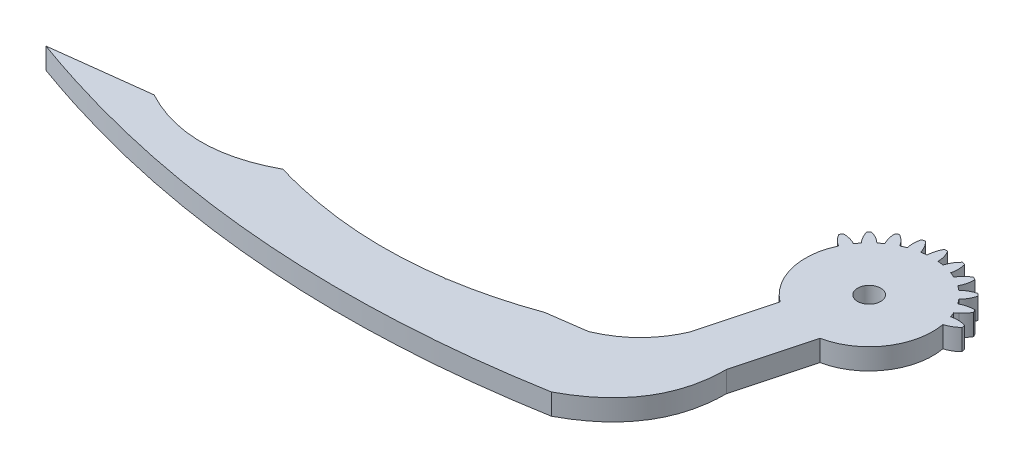
from build123d import *
from build123d.topology import SkipClean

# Parameters (mm, degrees)
SKETCH1_R           = 1.5
BOSS_EXTRUDE1_DEPTH = 4
SKETCH3_R           = 1.75
BOSS_EXTRUDE2_DEPTH = 4
CUT_EXTRUDE1_START  = -4
CUT_EXTRUDE1_DEPTH  = 4
CUT_EXTRUDE2_REACH  = 49.1
SKETCH5_R           = 2.2
BOSS_EXTRUDE3_START = -4
BOSS_EXTRUDE3_DEPTH = 4
CUT_EXTRUDE3_START  = -10
SKETCH6_3_R         = 1.75
CUT_EXTRUDE3_DEPTH  = 10


with BuildPart() as part:
    # Sketch1 → Boss-Extrude1 (new body)
    with BuildSketch(Plane(origin=(0, 0, 0), x_dir=(1, 0, 0), z_dir=(0, 1, 0))):
        with BuildLine():
            Line((19.858482165, 7.979459856), (1.45526727, 5.556630652))
            ThreePointArc((1.45526727, 5.556630652), (2.151210177, 6.241530576), (2.71243846, 7.040559518))
            ThreePointArc((2.71243846, 7.040559518), (2.559278977, 7.3125), (2.400351352, 7.581110245))
            ThreePointArc((2.400351352, 7.581110245), (1.062931662, 7.415362311), (-0.19179738, 6.923611525))
            ThreePointArc((-0.19179738, 6.923611525), (-0.512518948, 7.361599771), (-0.852574256, 7.784752716))
            ThreePointArc((-0.852574256, 7.784752716), (-0.0528317, 8.869453434), (0.453418198, 10.118402931))
            ThreePointArc((0.453418198, 10.118402931), (0.235094121, 10.341436675), (0.012060377, 10.559760751))
            ThreePointArc((0.012060377, 10.559760751), (-1.23688912, 10.053510854), (-2.321589838, 9.253768298))
            ThreePointArc((-2.321589838, 9.253768298), (-2.744742783, 9.593823606), (-3.182731029, 9.914545174))
            ThreePointArc((-3.182731029, 9.914545174), (-2.690980243, 11.169274216), (-2.525232309, 12.506693906))
            ThreePointArc((-2.525232309, 12.506693906), (-2.793842554, 12.66562153), (-3.065783036, 12.818781014))
            ThreePointArc((-3.065783036, 12.818781014), (-4.141148496, 12.006529247), (-4.981900329, 10.953296054))
            ThreePointArc((-4.981900329, 10.953296054), (-5.478647477, 11.172244217), (-5.984720485, 11.368677763))
            ThreePointArc((-5.984720485, 11.368677763), (-5.834473474, 12.707927419), (-6.020522951, 14.04267436))
            ThreePointArc((-6.020522951, 14.04267436), (-6.321114019, 14.126665209), (-6.623428946, 14.204222534))
            ThreePointArc((-6.623428946, 14.204222534), (-7.451925989, 13.141322514), (-7.991433089, 11.906374785))
            ThreePointArc((-7.991433089, 11.906374785), (-8.527921943, 11.989294847), (-9.067591674, 12.04805375))
            ThreePointArc((-9.067591674, 12.04805375), (-9.269087523, 13.380556368), (-9.794255446, 14.621669762))
            ThreePointArc((-9.794255446, 14.621669762), (-10.106342554, 14.625), (-10.418429662, 14.621669762))
            ThreePointArc((-10.418429662, 14.621669762), (-10.943597585, 13.380556368), (-11.145093433, 12.04805375))
            ThreePointArc((-11.145093433, 12.04805375), (-11.684763165, 11.989294847), (-12.221252019, 11.906374785))
            ThreePointArc((-12.221252019, 11.906374785), (-12.760759118, 13.141322514), (-13.589256162, 14.204222534))
            ThreePointArc((-13.589256162, 14.204222534), (-13.891571088, 14.126665209), (-14.192162157, 14.04267436))
            ThreePointArc((-14.192162157, 14.04267436), (-14.378211634, 12.707927419), (-14.227964623, 11.368677763))
            ThreePointArc((-14.227964623, 11.368677763), (-14.734037631, 11.172244217), (-15.230784779, 10.953296054))
            ThreePointArc((-15.230784779, 10.953296054), (-16.071536612, 12.006529247), (-17.146902071, 12.818781014))
            ThreePointArc((-17.146902071, 12.818781014), (-17.418842554, 12.66562153), (-17.687452799, 12.506693906))
            ThreePointArc((-17.687452799, 12.506693906), (-17.521704864, 11.169274216), (-17.029954079, 9.914545174))
            ThreePointArc((-17.029954079, 9.914545174), (-17.467942324, 9.593823606), (-17.89109527, 9.253768298))
            ThreePointArc((-17.89109527, 9.253768298), (-18.975795988, 10.053510854), (-20.224745485, 10.559760751))
            ThreePointArc((-20.224745485, 10.559760751), (-20.447779229, 10.341436675), (-20.666103305, 10.118402931))
            ThreePointArc((-20.666103305, 10.118402931), (-20.159853408, 8.869453434), (-19.360110852, 7.784752716))
            ThreePointArc((-19.360110852, 7.784752716), (-19.70016616, 7.361599771), (-20.020887728, 6.923611525))
            ThreePointArc((-20.020887728, 6.923611525), (-21.27561677, 7.415362311), (-22.61303646, 7.581110245))
            ThreePointArc((-22.61303646, 7.581110245), (-22.771964084, 7.3125), (-22.925123568, 7.040559518))
            ThreePointArc((-22.925123568, 7.040559518), (-22.112871801, 5.965194058), (-21.059638608, 5.124442225))
            ThreePointArc((-21.059638608, 5.124442225), (-21.278586771, 4.627695077), (-21.475020317, 4.121622069))
            ThreePointArc((-21.475020317, 4.121622069), (-22.814269973, 4.27186908), (-24.149016913, 4.085819603))
            ThreePointArc((-24.149016913, 4.085819603), (-24.233007763, 3.785228535), (-24.310565088, 3.482913608))
            ThreePointArc((-24.310565088, 3.482913608), (-23.247665068, 2.654416564), (-22.012717339, 2.114909465))
            ThreePointArc((-22.012717339, 2.114909465), (-22.095637401, 1.578420611), (-22.154396304, 1.03875088))
            ThreePointArc((-22.154396304, 1.03875088), (-23.486898922, 0.837255031), (-24.728012316, 0.312087108))
            ThreePointArc((-24.728012316, 0.312087108), (-24.731342554, 0), (-24.728012316, -0.312087108))
            ThreePointArc((-24.728012316, -0.312087108), (-23.486898922, -0.837255031), (-22.154396304, -1.03875088))
            ThreePointArc((-22.154396304, -1.03875088), (-22.095637401, -1.578420611), (-22.012717339, -2.114909465))
            ThreePointArc((-22.012717339, -2.114909465), (-23.247665068, -2.654416564), (-24.310565088, -3.482913608))
            ThreePointArc((-24.310565088, -3.482913608), (-24.233007763, -3.785228535), (-24.149016913, -4.085819603))
            ThreePointArc((-24.149016913, -4.085819603), (-22.814269973, -4.27186908), (-21.475020317, -4.121622069))
            ThreePointArc((-21.475020317, -4.121622069), (-21.278586771, -4.627695077), (-21.059638608, -5.124442225))
            ThreePointArc((-21.059638608, -5.124442225), (-22.112871801, -5.965194058), (-22.925123568, -7.040559518))
            ThreePointArc((-22.925123568, -7.040559518), (-22.771964084, -7.3125), (-22.61303646, -7.581110245))
            ThreePointArc((-22.61303646, -7.581110245), (-21.27561677, -7.415362311), (-20.020887728, -6.923611525))
            ThreePointArc((-20.020887728, -6.923611525), (-19.70016616, -7.361599771), (-19.360110852, -7.784752716))
            ThreePointArc((-19.360110852, -7.784752716), (-20.159853408, -8.869453434), (-20.666103305, -10.118402931))
            ThreePointArc((-20.666103305, -10.118402931), (-20.447779229, -10.341436675), (-20.224745485, -10.559760751))
            ThreePointArc((-20.224745485, -10.559760751), (-18.975795988, -10.053510854), (-17.89109527, -9.253768298))
            ThreePointArc((-17.89109527, -9.253768298), (-17.467942324, -9.593823606), (-17.029954079, -9.914545174))
            ThreePointArc((-17.029954079, -9.914545174), (-17.521704864, -11.169274216), (-17.687452799, -12.506693906))
            ThreePointArc((-17.687452799, -12.506693906), (-17.418842554, -12.66562153), (-17.146902071, -12.818781014))
            ThreePointArc((-17.146902071, -12.818781014), (-16.071536612, -12.006529247), (-15.230784779, -10.953296054))
            ThreePointArc((-15.230784779, -10.953296054), (-14.734037631, -11.172244217), (-14.227964623, -11.368677763))
            ThreePointArc((-14.227964623, -11.368677763), (-14.378211634, -12.707927419), (-14.192162157, -14.04267436))
            ThreePointArc((-14.192162157, -14.04267436), (-13.891571088, -14.126665209), (-13.589256162, -14.204222534))
            ThreePointArc((-13.589256162, -14.204222534), (-12.760759118, -13.141322514), (-12.221252019, -11.906374785))
            ThreePointArc((-12.221252019, -11.906374785), (-11.684763165, -11.989294847), (-11.145093433, -12.04805375))
            ThreePointArc((-11.145093433, -12.04805375), (-10.943597585, -13.380556368), (-10.418429662, -14.621669762))
            ThreePointArc((-10.418429662, -14.621669762), (-10.106342554, -14.625), (-9.794255446, -14.621669762))
            ThreePointArc((-9.794255446, -14.621669762), (-9.269087523, -13.380556368), (-9.067591674, -12.04805375))
            ThreePointArc((-9.067591674, -12.04805375), (-8.527921943, -11.989294847), (-7.991433089, -11.906374785))
            ThreePointArc((-7.991433089, -11.906374785), (-7.451925989, -13.141322514), (-6.623428946, -14.204222534))
            ThreePointArc((-6.623428946, -14.204222534), (-6.321114019, -14.126665209), (-6.020522951, -14.04267436))
            ThreePointArc((-6.020522951, -14.04267436), (-5.834473474, -12.707927419), (-5.984720485, -11.368677763))
            ThreePointArc((-5.984720485, -11.368677763), (-5.478647477, -11.172244217), (-4.981900329, -10.953296054))
            ThreePointArc((-4.981900329, -10.953296054), (-4.141148496, -12.006529247), (-3.065783036, -12.818781014))
            ThreePointArc((-3.065783036, -12.818781014), (-2.793842554, -12.66562153), (-2.525232309, -12.506693906))
            ThreePointArc((-2.525232309, -12.506693906), (-2.690980243, -11.169274216), (-3.182731029, -9.914545174))
            ThreePointArc((-3.182731029, -9.914545174), (-2.744742783, -9.593823606), (-2.321589838, -9.253768298))
            ThreePointArc((-2.321589838, -9.253768298), (-1.23688912, -10.053510854), (0.012060377, -10.559760751))
            ThreePointArc((0.012060377, -10.559760751), (0.235094121, -10.341436675), (0.453418198, -10.118402931))
            ThreePointArc((0.453418198, -10.118402931), (-0.0528317, -8.869453434), (-0.852574256, -7.784752716))
            ThreePointArc((-0.852574256, -7.784752716), (-0.512518948, -7.361599771), (-0.19179738, -6.923611525))
            ThreePointArc((-0.19179738, -6.923611525), (1.062931662, -7.415362311), (2.400351352, -7.581110245))
            ThreePointArc((2.400351352, -7.581110245), (2.559278977, -7.3125), (2.71243846, -7.040559518))
            ThreePointArc((2.71243846, -7.040559518), (1.900186694, -5.965194058), (0.8469535, -5.124442225))
            ThreePointArc((0.8469535, -5.124442225), (1.065901663, -4.627695077), (1.262335209, -4.121622069))
            ThreePointArc((1.262335209, -4.121622069), (2.601584865, -4.27186908), (3.936331806, -4.085819603))
            ThreePointArc((3.936331806, -4.085819603), (4.020322656, -3.785228535), (4.09787998, -3.482913608))
            ThreePointArc((4.09787998, -3.482913608), (3.348971179, -2.856367486), (2.499476808, -2.374928239))
            Line((2.499476808, -2.374928239), (20.902691702, 0.047900965))
            ThreePointArc((20.902691702, 0.047900965), (24.346366379, 4.53578518), (19.858482165, 7.979459856))
        make_face()
        with Locations(Location((-10.106342554, 0, 0), (0, 0, 270))):
            Circle(SKETCH1_R, mode=Mode.SUBTRACT)
        with Locations(Location((20.380586933, 4.013680411, 0), (0, 0, 270))):
            Circle(SKETCH1_R, mode=Mode.SUBTRACT)
    extrude(amount=BOSS_EXTRUDE1_DEPTH)

    # Sketch3 → Boss-Extrude2 (add)
    with BuildSketch(Plane(origin=(0, 4, 0), x_dir=(1, 0, 0), z_dir=(0, 1, 0))):
        with BuildLine():
            Line((-10.628447323, 3.965779445), (-41.11537681, -0.047900965))
            ThreePointArc((-41.11537681, -0.047900965), (-44.559051487, -4.53578518), (-40.071167272, -7.979459856))
            Line((-40.071167272, -7.979459856), (-9.584237785, -3.965779445))
            ThreePointArc((-9.584237785, -3.965779445), (-14.072121999, -0.522104769), (-10.628447323, 3.965779445))
        make_face()
        with Locations(Location((-40.593272041, -4.013680411, 0), (0, 0, 270))):
            Circle(SKETCH3_R, mode=Mode.SUBTRACT)
    extrude(amount=-BOSS_EXTRUDE2_DEPTH)

    # Sketch4 → Cut-Extrude1 (cut)
    with SkipClean():  # the faces are left unmerged after this step: merging them gives an invalid solid
        with BuildSketch(Plane(origin=(0, 4, 0), x_dir=(1, 0, 0), z_dir=(0, 1, 0)).offset(CUT_EXTRUDE1_START)):
            with BuildLine():
                ThreePointArc((20.902691702, 0.047900965), (24.346366379, 4.53578518), (19.858482165, 7.979459856))
                Line((19.858482165, 7.979459856), (1.45526727, 5.556630652))
                Line((1.45526727, 5.556630652), (0.869405378, 5.076175716))
                ThreePointArc((0.869405378, 5.076175716), (1.076060277, 4.603093469), (1.262335209, 4.121622069))
                ThreePointArc((1.262335209, 4.121622069), (2.601584865, 4.27186908), (3.936331806, 4.085819603))
                ThreePointArc((3.936331806, 4.085819603), (4.020322656, 3.785228535), (4.09787998, 3.482913608))
                ThreePointArc((4.09787998, 3.482913608), (3.03497996, 2.654416564), (1.800032231, 2.114909465))
                ThreePointArc((1.800032231, 2.114909465), (1.941711197, -1.03875088), (1.262335209, -4.121622069))
                ThreePointArc((1.262335209, -4.121622069), (2.601584865, -4.27186908), (3.936331806, -4.085819603))
                ThreePointArc((3.936331806, -4.085819603), (4.020322656, -3.785228535), (4.09787998, -3.482913608))
                ThreePointArc((4.09787998, -3.482913608), (3.348971179, -2.856367486), (2.499476808, -2.374928239))
                Line((2.499476808, -2.374928239), (20.902691702, 0.047900965))
            make_face()
            with BuildLine():
                ThreePointArc((2.71243846, -7.040559518), (1.900186694, -5.965194058), (0.8469535, -5.124442225))
                ThreePointArc((0.8469535, -5.124442225), (0.366286148, -6.046375), (-0.19179738, -6.923611525))
                ThreePointArc((-0.19179738, -6.923611525), (1.062931662, -7.415362311), (2.400351352, -7.581110245))
                ThreePointArc((2.400351352, -7.581110245), (2.559278977, -7.3125), (2.71243846, -7.040559518))
            make_face()
            with BuildLine():
                ThreePointArc((0.453418198, -10.118402931), (-0.0528317, -8.869453434), (-0.852574256, -7.784752716))
                ThreePointArc((-0.852574256, -7.784752716), (-1.555477026, -8.550865528), (-2.321589838, -9.253768298))
                ThreePointArc((-2.321589838, -9.253768298), (-1.23688912, -10.053510854), (0.012060377, -10.559760751))
                ThreePointArc((0.012060377, -10.559760751), (0.235094121, -10.341436675), (0.453418198, -10.118402931))
            make_face()
            with BuildLine():
                ThreePointArc((-2.525232309, -12.506693906), (-2.690980243, -11.169274216), (-3.182731029, -9.914545174))
                ThreePointArc((-3.182731029, -9.914545174), (-4.059967554, -10.472628702), (-4.981900329, -10.953296054))
                ThreePointArc((-4.981900329, -10.953296054), (-4.141148496, -12.006529247), (-3.065783036, -12.818781014))
                ThreePointArc((-3.065783036, -12.818781014), (-2.793842554, -12.66562153), (-2.525232309, -12.506693906))
            make_face()
            with BuildLine():
                ThreePointArc((-6.020522951, -14.04267436), (-5.834473474, -12.707927419), (-5.984720485, -11.368677763))
                ThreePointArc((-5.984720485, -11.368677763), (-6.976508546, -11.680699536), (-7.991433089, -11.906374785))
                ThreePointArc((-7.991433089, -11.906374785), (-7.451925989, -13.141322514), (-6.623428946, -14.204222534))
                ThreePointArc((-6.623428946, -14.204222534), (-6.321114019, -14.126665209), (-6.020522951, -14.04267436))
            make_face()
            with BuildLine():
                ThreePointArc((-9.794255446, -14.621669762), (-9.269087523, -13.380556368), (-9.067591674, -12.04805375))
                ThreePointArc((-9.067591674, -12.04805375), (-10.106342554, -12.09275), (-11.145093433, -12.04805375))
                ThreePointArc((-11.145093433, -12.04805375), (-10.943597585, -13.380556368), (-10.418429662, -14.621669762))
                ThreePointArc((-10.418429662, -14.621669762), (-10.106342554, -14.625), (-9.794255446, -14.621669762))
            make_face()
            with BuildLine():
                ThreePointArc((-13.589256162, -14.204222534), (-12.760759118, -13.141322514), (-12.221252019, -11.906374785))
                ThreePointArc((-12.221252019, -11.906374785), (-13.236176561, -11.680699536), (-14.227964623, -11.368677763))
                ThreePointArc((-14.227964623, -11.368677763), (-14.378211634, -12.707927419), (-14.192162157, -14.04267436))
                ThreePointArc((-14.192162157, -14.04267436), (-13.891571088, -14.126665209), (-13.589256162, -14.204222534))
            make_face()
            with BuildLine():
                ThreePointArc((-17.146902071, -12.818781014), (-16.071536612, -12.006529247), (-15.230784779, -10.953296054))
                ThreePointArc((-15.230784779, -10.953296054), (-16.152717554, -10.472628702), (-17.029954079, -9.914545174))
                ThreePointArc((-17.029954079, -9.914545174), (-17.521704864, -11.169274216), (-17.687452799, -12.506693906))
                ThreePointArc((-17.687452799, -12.506693906), (-17.418842554, -12.66562153), (-17.146902071, -12.818781014))
            make_face()
            with BuildLine():
                ThreePointArc((-21.942853375, 2.47620963), (-21.738068128, 3.307198622), (-21.475020317, 4.121622069))
                ThreePointArc((-21.475020317, 4.121622069), (-22.814269973, 4.27186908), (-24.149016913, 4.085819603))
                ThreePointArc((-24.149016913, 4.085819603), (-24.233007763, 3.785228535), (-24.310565088, 3.482913608))
                ThreePointArc((-24.310565088, 3.482913608), (-23.561656287, 2.856367486), (-22.712161916, 2.374928239))
                Line((-22.712161916, 2.374928239), (-21.942853375, 2.47620963))
            make_face()
            with BuildLine():
                ThreePointArc((-20.224745485, -10.559760751), (-18.975795988, -10.053510854), (-17.89109527, -9.253768298))
                ThreePointArc((-17.89109527, -9.253768298), (-18.657208082, -8.550865528), (-19.360110852, -7.784752716))
                ThreePointArc((-19.360110852, -7.784752716), (-20.159853408, -8.869453434), (-20.666103305, -10.118402931))
                ThreePointArc((-20.666103305, -10.118402931), (-20.447779229, -10.341436675), (-20.224745485, -10.559760751))
            make_face()
            with BuildLine():
                ThreePointArc((-20.020887728, -6.923611525), (-20.485760701, -6.205020667), (-20.898643838, -5.455349261))
                Line((-20.898643838, -5.455349261), (-21.667952378, -5.556630652))
                ThreePointArc((-21.667952378, -5.556630652), (-22.363895284, -6.241530576), (-22.925123568, -7.040559518))
                ThreePointArc((-22.925123568, -7.040559518), (-22.771964084, -7.3125), (-22.61303646, -7.581110245))
                ThreePointArc((-22.61303646, -7.581110245), (-21.27561677, -7.415362311), (-20.020887728, -6.923611525))
            make_face()
        extrude(amount=CUT_EXTRUDE1_DEPTH, mode=Mode.SUBTRACT)

    # Sketch5 → Cut-Extrude2 (cut, up to next)
    with BuildSketch(Plane(origin=(0, 4, 0), x_dir=(1, 0, 0), z_dir=(0, 1, 0)), mode=Mode.PRIVATE) as cut_extrude2_sk1:
        with Locations(Location((-10.106342554, 0, 0), (0, 0, 270))):
            Circle(SKETCH5_R)
    cut_extrude2_tool1 = extrude(cut_extrude2_sk1.sketch, amount=-CUT_EXTRUDE2_REACH, mode=Mode.PRIVATE) & part.part
    add(cut_extrude2_tool1.solids().sort_by_distance((-10.106343, 4, 0))[0], mode=Mode.SUBTRACT)

    # Sketch6 → Boss-Extrude3 (add)
    with SkipClean():  # the faces are left unmerged after this step: merging them gives an invalid solid
        with BuildSketch(Plane(origin=(0, 4, 0), x_dir=(1, 0, 0), z_dir=(0, 1, 0)).offset(BOSS_EXTRUDE3_START)):
            with BuildLine():
                ThreePointArc((-52.962051912, -37.720188973), (-53.029457116, -37.643685191), (-53.094890456, -37.565488207))
                add(Edge.make_bspline(
                    [(-53.094890456, -37.565488207), (-69.574492007, -40.022931453), (-86.473755851, -35.03783058)],
                    knots=[0.398617796, 0.398617796, 0.398617796, 1, 1, 1], degree=2))
                add(Edge.make_bspline(
                    [(-86.473755851, -35.03783058), (-98.679286779, -41.59959414), (-110.954647006, -35.03783058)],
                    knots=[0, 0, 0, 1, 1, 1], degree=2))
                Line((-110.954647006, -35.03783058), (-129.244737731, -37.275679444))
                add(Edge.make_bspline(
                    [(-24.307799862, -46.178856242), (-78.550492212, -55.693347591), (-129.244737731, -37.275679444)],
                    knots=[0.002349817, 0.002349817, 0.002349817, 1, 1, 1], degree=2))
                add(Edge.make_bspline(
                    [(-24.307799862, -46.178856242), (-11.325946224, -39.297851738), (-11.379295158, -25.85254802)],
                    knots=[0, 0, 0, 1, 1, 1], degree=2))
                Line((-11.379295158, -25.85254802), (-10.692878437, -23.290805939))
                Line((-10.692878437, -23.290805939), (-7.62332727, -11.83508503))
                ThreePointArc((-7.62332727, -11.83508503), (-7.874404331, -11.88499282), (-8.126481564, -11.929574721))
                ThreePointArc((-8.126481564, -11.929574721), (-12.992916327, -11.743180762), (-17.391194669, -9.652229391))
                Line((-17.391194669, -9.652229391), (-20.453641162, -21.0814353))
                Line((-20.453641162, -21.0814353), (-20.986801846, -23.071218061))
                add(Edge.make_bspline(
                    [(-30.706376797, -32.703441208), (-23.88923072, -29.810908187), (-20.986801846, -23.071218061)],
                    knots=[0, 0, 0, 1, 1, 1], degree=2))
                Line((-30.706376797, -32.703441208), (-31.121289752, -32.76140473))
                Line((-31.121289752, -32.76140473), (-38.003060246, -33.722791093))
                add(Edge.make_bspline(
                    [(-38.003060246, -33.722791093), (-45.394684007, -36.393930701), (-52.872751681, -37.532021826)],
                    knots=[0.121623856, 0.121623856, 0.121623856, 0.394564246, 0.394564246, 0.394564246], degree=2))
                ThreePointArc((-52.872751681, -37.532021826), (-52.918626749, -37.625524062), (-52.962051912, -37.720188973))
            make_face()
        extrude(amount=BOSS_EXTRUDE3_DEPTH)

    # Sketch6<3> → Cut-Extrude3 (cut)
    with SkipClean():  # the faces are left unmerged after this step: merging them gives an invalid solid
        with BuildSketch(Plane(origin=(0, 4, 0), x_dir=(1, 0, 0), z_dir=(0, 1, 0)).offset(CUT_EXTRUDE3_START)):
            with BuildLine():
                Line((-40.071167272, -7.979459856), (-20.898643838, -5.455349261))
                ThreePointArc((-20.898643838, -5.455349261), (-22.095637401, -1.578420611), (-21.942853375, 2.47620963))
                Line((-21.942853375, 2.47620963), (-41.11537681, -0.047900965))
                ThreePointArc((-41.11537681, -0.047900965), (-44.592679619, -4.082521016), (-40.978584416, -7.995078956))
                ThreePointArc((-40.978584416, -7.995078956), (-40.524431436, -8.013087988), (-40.071167272, -7.979459856))
            make_face()
            with Locations((-40.593272041, -4.013680411)):
                Circle(SKETCH6_3_R, mode=Mode.SUBTRACT)
        extrude(amount=CUT_EXTRUDE3_DEPTH, mode=Mode.SUBTRACT)


solid = part.part
